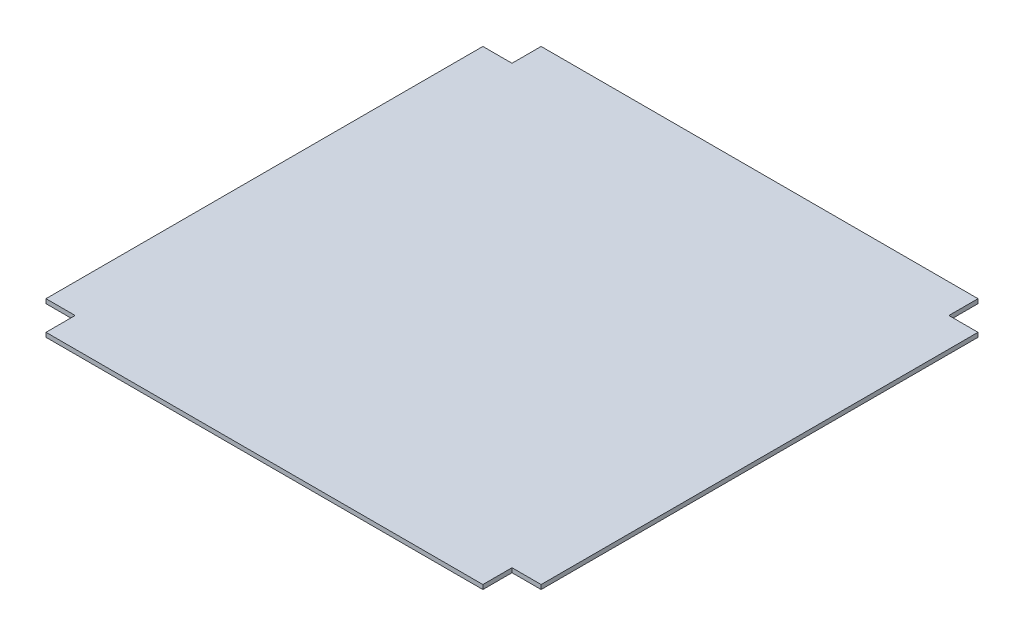
from build123d import *

# Parameters (mm, degrees)
BOSS_EXTRUDE1_DEPTH = 3


with BuildPart() as part:
    # Sketch1 → Boss-Extrude1 (new body)
    with BuildSketch(Plane(origin=(0, 0, 0), x_dir=(1, 0, 0), z_dir=(0, 1, 0))):
        Polygon((20, 20), (20, 0), (320, 0), (320, 20), (340, 20), (340, 320), (320, 320), (320, 340), (20, 340), (20, 320), (0, 320), (0, 20), align=None)
    extrude(amount=BOSS_EXTRUDE1_DEPTH)


solid = part.part
